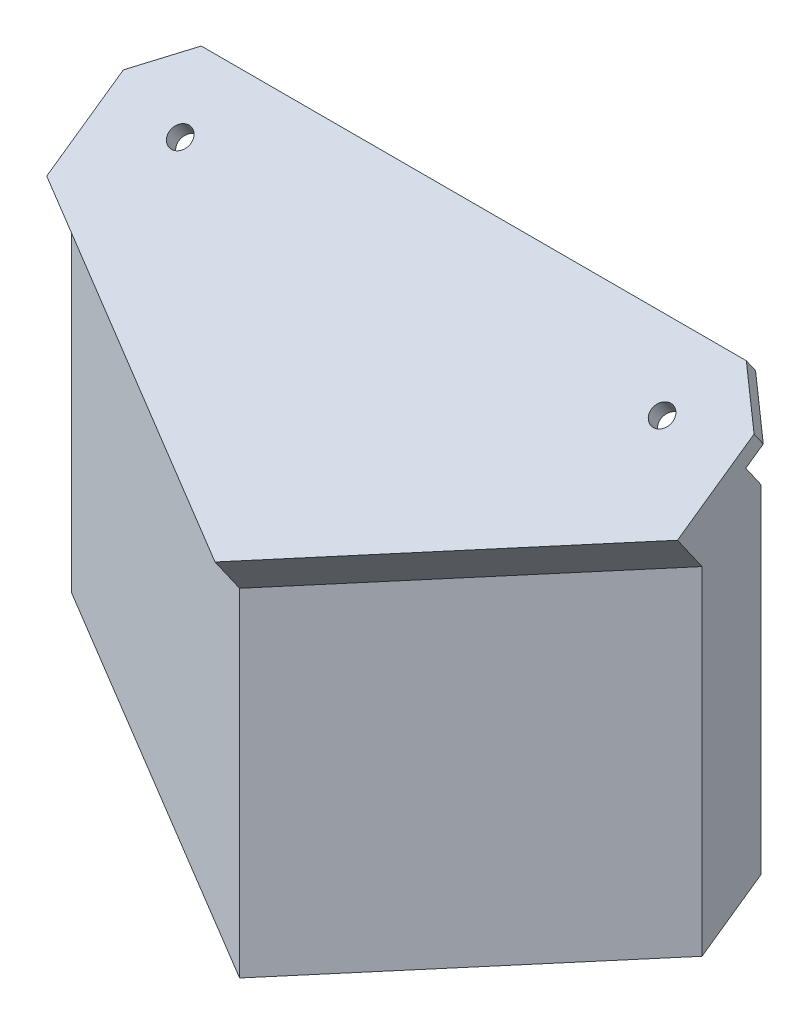
from build123d import *

# Parameters (mm, degrees)
EXTRUDE_2_DEPTH          = 90
CUT_EXTRUDE_1_DEPTH      = 114.317207464
CUT_EXTRUDE_1_DEPTH_BACK = 114.317207464
EXTRUDE_3_DEPTH          = 8
SKETCH_8_OUTSIDE_W       = 163.572
SKETCH_8_OUTSIDE_H       = 147.98
SKETCH_8_OUTSIDE_W_2     = 117.820012314
SKETCH_8_OUTSIDE_H_2     = 106.962978805
CUT_EXTRUDE_2_DEPTH      = 117.531399887
SKETCH_9_R               = 2
CUT_EXTRUDE_3_DEPTH      = 115.369004136
SKETCH_10_W              = 117.820012314
SKETCH_10_H              = 8
CUT_EXTRUDE_4_DEPTH      = 20
CUT_EXTRUDE_6_DEPTH      = 5
CHAMFER_1_SIZE           = 8


with BuildPart() as part:
    # 草图5 → 拉伸-薄壁2 (new body)
    with BuildSketch(Plane(origin=(0, 0, 0), x_dir=(1, 0, 0), z_dir=(0, 1, 0))):
        Polygon((-58.910006157, 27.470187013), (0, 0), (58.910006157, 27.470187013), (63.136188775, 18.407109143), (0, -11.03377919), (-63.136188775, 18.407109143), align=None)
    extrude(amount=EXTRUDE_2_DEPTH)

    # 草图6 → 切除-拉伸1 (cut, two sides: drawn at the far end of the back side and taken through both)
    with BuildSketch(Plane(origin=(0, 0, 0), x_dir=(0, 0, -1), z_dir=(1, 0, 0)).offset(-CUT_EXTRUDE_1_DEPTH_BACK)):
        Polygon((-11.03377919, 0), (27.470187013, 26.960767386), (27.470187013, 0), align=None)
        Polygon((27.470187013, 90), (-11.03377919, 63.039232614), (-11.03377919, 90), align=None)
    extrude(amount=CUT_EXTRUDE_1_DEPTH + CUT_EXTRUDE_1_DEPTH_BACK, mode=Mode.SUBTRACT)

    # 草图7 → 凸台-拉伸3 (add)
    with BuildSketch(Plane(origin=(0, 47.484140436, 33.248753079), x_dir=(1, 0, 0), z_dir=(0, 0.8191520442889949, 0.5735764363510419))):
        Polygon((63.136188775, 63.06016396), (58.910006157, 74.12413912), (58.910006157, 94.12413912), (-58.910006157, 94.12413912), (-58.910006157, 74.12413912), (-63.136188775, 63.06016396), (0, 27.119475614), align=None)
    extrude(amount=EXTRUDE_3_DEPTH)

    # 草图8 outside → 切除-拉伸2 (cut, through all)
    with BuildSketch(Plane(origin=(0, 54.03735679, 37.837364569), x_dir=(1, 0, 0), z_dir=(0, 0.8191520442889948, 0.5735764363510418))):
        with Locations((0, 42.543)):
            Rectangle(SKETCH_8_OUTSIDE_W, SKETCH_8_OUTSIDE_H)
        with Locations((0, 40.642649718)):
            Rectangle(SKETCH_8_OUTSIDE_W_2, SKETCH_8_OUTSIDE_H_2, mode=Mode.SUBTRACT)
    extrude(amount=-CUT_EXTRUDE_2_DEPTH, mode=Mode.SUBTRACT)

    # 草图9 → 切除-拉伸3 (cut, through all)
    with BuildSketch(Plane(origin=(0, 47.484140436, 33.248753079), x_dir=(1, 0, 0), z_dir=(0, -0.8191520442889949, -0.5735764363510419))):
        with Locations(Location((-45, -74.12413912, 0), (0, 0, 270))):
            Circle(SKETCH_9_R)
        with Locations(Location((45, -74.12413912, 0), (0, 0, 270))):
            Circle(SKETCH_9_R)
    extrude(amount=-CUT_EXTRUDE_3_DEPTH, mode=Mode.SUBTRACT)

    # 草图10 → 切除-拉伸4 (cut)
    with BuildSketch(Plane(origin=(0, 47.484140436, 33.248753079), x_dir=(1, 0, 0), z_dir=(0, -0.8191520442889949, -0.5735764363510419))):
        with Locations((0, -90.12413912)):
            Rectangle(SKETCH_10_W, SKETCH_10_H)
    extrude(amount=-CUT_EXTRUDE_4_DEPTH, mode=Mode.SUBTRACT)

    # 草图11 → 切除-拉伸6 (cut)
    with BuildSketch(Plane(origin=(0, 47.484140436, 33.248753079), x_dir=(1, 0, 0), z_dir=(0, -0.8191520442889949, -0.5735764363510419))):
        Polygon((-58.910006157, -86.12413912), (58.910006157, -86.12413912), (58.910006157, -74.12413912), (0, -40.589232866), (-58.910006157, -74.12413912), align=None)
    extrude(amount=-CUT_EXTRUDE_6_DEPTH, mode=Mode.SUBTRACT)

    # 倒角1
    chamfer_1_edges = [part.edges().sort_by_distance(p)[0] for p in [
        (-58.910006157, 102.207405524, -33.571764708),
        (58.910006157, 102.207405524, -33.571764708),
    ]]
    chamfer(chamfer_1_edges, length=CHAMFER_1_SIZE)


solid = part.part
